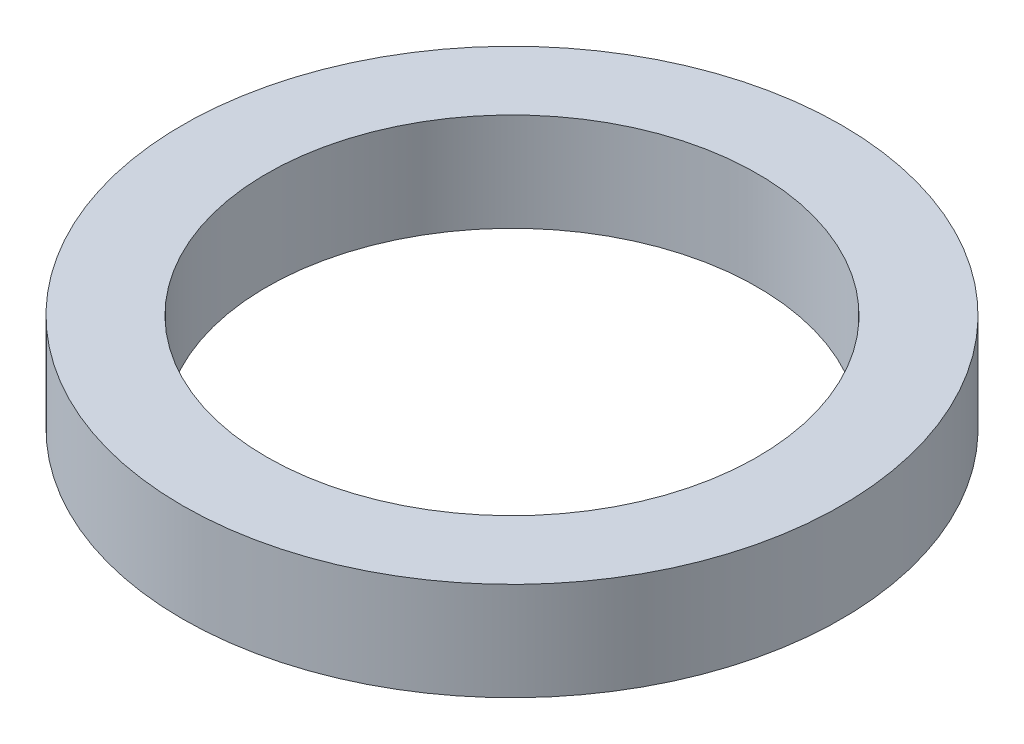
from build123d import *

# Parameters (mm, degrees)
SKETCH_1_R        = 23.5
SKETCH_1_R_2      = 17.5
EXTRUDE_329_DEPTH = 7


with BuildPart() as part:
    # Эскиз1 → Extrude 329 (new body)
    with BuildSketch(Plane(origin=(0, 0, 0), x_dir=(1, 0, 0), z_dir=(0, 1, 0))):
        with Locations(Location((0, 0, 0), (0, 0, 270))):
            Circle(SKETCH_1_R)
        with Locations(Location((0, 0, 0), (0, 0, 270))):
            Circle(SKETCH_1_R_2, mode=Mode.SUBTRACT)
    extrude(amount=EXTRUDE_329_DEPTH)


solid = part.part
